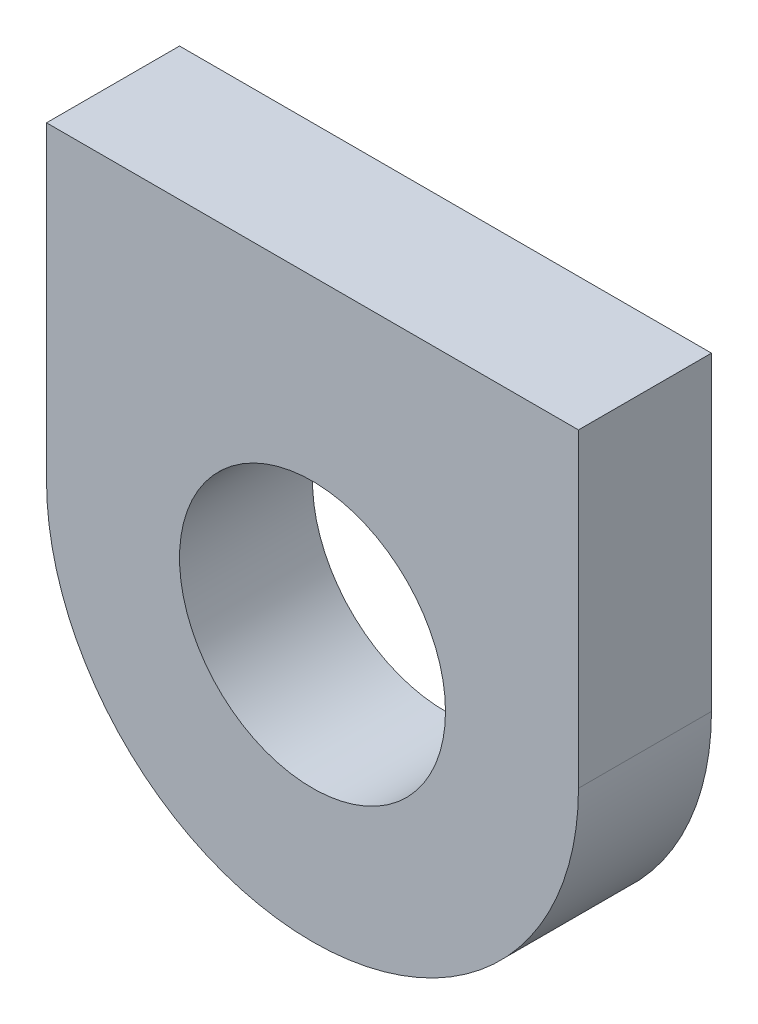
from build123d import *

# Parameters (mm, degrees)
SKETCH1_R           = 15
BOSS_EXTRUDE1_DEPTH = 15


with BuildPart() as part:
    # Sketch1 → Boss-Extrude1 (new body)
    with BuildSketch(Plane.XY):
        with BuildLine():
            Line((-30, 0), (-30, 35))
            Line((-30, 35), (30, 35))
            Line((30, 35), (30, 0))
            ThreePointArc((30, 0), (0, -30), (-30, 0))
        make_face()
        Circle(SKETCH1_R, mode=Mode.SUBTRACT)
    extrude(amount=BOSS_EXTRUDE1_DEPTH)


solid = part.part
